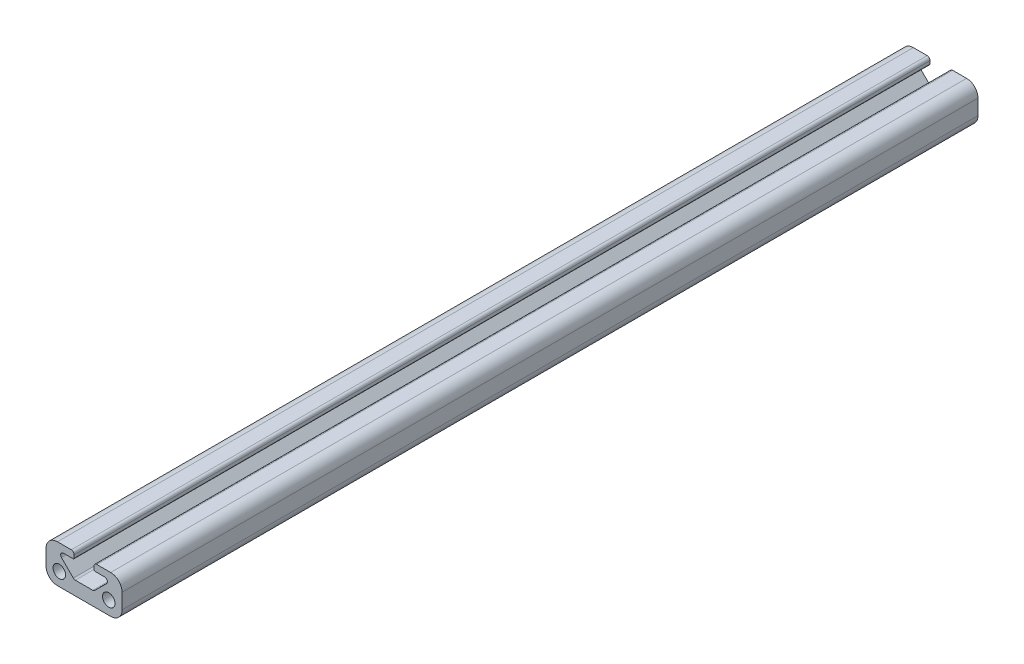
from build123d import *

# Parameters (mm, degrees)
SKETCH1_R            = 1.65
BOSS_EXTRUDE1_DEPTH  = 112.5
M5_CLEARANCE_HOLE1_D = 5.2


with BuildPart() as part:
    # Sketch1 → Boss-Extrude1 (new, symmetric)
    with BuildSketch(Plane.XY):
        with BuildLine():
            Line((-7, 10), (-3.35, 10))
            ThreePointArc((-3.35, 10), (-2.819669914, 9.780330086), (-2.6, 9.25))
            Line((-2.6, 9.25), (-2.6, 8.45))
            ThreePointArc((-2.6, 8.45), (-2.673223305, 8.273223305), (-2.85, 8.2))
            Line((-2.85, 8.2), (-5.389339828, 8.2))
            ThreePointArc((-5.389339828, 8.2), (-6.082249478, 7.737012574), (-5.919669914, 6.919669914))
            Line((-5.919669914, 6.919669914), (-2.819669914, 3.819669914))
            ThreePointArc((-2.819669914, 3.819669914), (-2.576352402, 3.657090351), (-2.289339828, 3.6))
            Line((-2.289339828, 3.6), (2.289339828, 3.6))
            ThreePointArc((2.289339828, 3.6), (2.576352402, 3.657090351), (2.819669914, 3.819669914))
            Line((2.819669914, 3.819669914), (5.919669914, 6.919669914))
            ThreePointArc((5.919669914, 6.919669914), (6.082249478, 7.737012574), (5.389339828, 8.2))
            Line((5.389339828, 8.2), (2.85, 8.2))
            ThreePointArc((2.85, 8.2), (2.673223305, 8.273223305), (2.6, 8.45))
            Line((2.6, 8.45), (2.6, 9.25))
            ThreePointArc((2.6, 9.25), (2.819669914, 9.780330086), (3.35, 10))
            Line((3.35, 10), (7, 10))
            ThreePointArc((7, 10), (9.121320344, 9.121320344), (10, 7))
            Line((10, 7), (10, 3))
            ThreePointArc((10, 3), (9.121320344, 0.878679656), (7, 0))
            Line((7, 0), (-7, 0))
            ThreePointArc((-7, 0), (-9.121320344, 0.878679656), (-10, 3))
            Line((-10, 3), (-10, 7))
            ThreePointArc((-10, 7), (-9.121320344, 9.121320344), (-7, 10))
        make_face()
        with Locations((-6.5, 3.5)):
            Circle(SKETCH1_R, mode=Mode.SUBTRACT)
        with Locations((6.5, 3.5)):
            Circle(SKETCH1_R, mode=Mode.SUBTRACT)
    extrude(amount=BOSS_EXTRUDE1_DEPTH, both=True)

    # M5 Clearance Hole1 (through all)
    with Locations(Plane(origin=(0, 0, 0), x_dir=(-1, 0, 0), z_dir=(0, -1, 0))):
        with Locations((0, 60), (0, -60)):
            Hole(M5_CLEARANCE_HOLE1_D / 2)


solid = part.part
